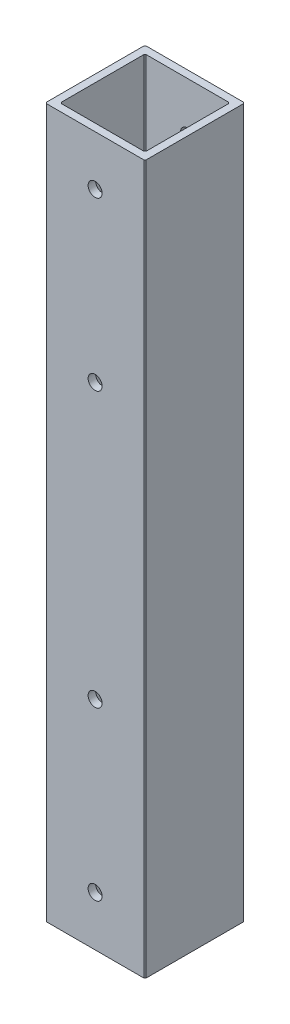
from build123d import *

# Parameters (mm, degrees)
SKETCH1_W                      = 40
SKETCH1_H                      = 284
BOSS_EXTRUDE1_DEPTH            = 40
SKETCH2_W                      = 34
SKETCH2_H                      = 34
CUT_EXTRUDE1_DEPTH             = 358.009803787
F_5_6_5_6_DIAMETER_HOLE1_D     = 5.6
F_5_6_5_6_DIAMETER_HOLE1_DEPTH = 3
F_5_6_5_6_DIAMETER_HOLE2_D     = 5.6
CHAMFER1_SIZE                  = 0.5


with BuildPart() as part:
    # Sketch1 → Boss-Extrude1 (new body)
    with BuildSketch(Plane.XY.offset(180)):
        with Locations((-100, 0)):
            Rectangle(SKETCH1_W, SKETCH1_H)
    extrude(amount=-BOSS_EXTRUDE1_DEPTH)

    # Sketch2 → Cut-Extrude1 (cut, through all)
    with BuildSketch(Plane.XZ.offset(142)):
        with Locations((-100, 160)):
            Rectangle(SKETCH2_W, SKETCH2_H)
    extrude(amount=-CUT_EXTRUDE1_DEPTH, mode=Mode.SUBTRACT)

    # Ø5.6 (5.6) Diameter Hole1
    with Locations(Plane(origin=(0, 0, 140), x_dir=(-1, 0, 0), z_dir=(0, 0, -1))):
        with Locations((100, 122), (100, 55), (100, -55), (100, -122)):
            Hole(F_5_6_5_6_DIAMETER_HOLE1_D / 2, depth=F_5_6_5_6_DIAMETER_HOLE1_DEPTH)

    # Ø5.6 (5.6) Diameter Hole2 (through all)
    with Locations(Plane(origin=(0, 0, 177), x_dir=(-1, 0, 0), z_dir=(0, 0, -1))):
        with Locations((100, 122), (100, 55), (100, -55), (100, -122)):
            Hole(F_5_6_5_6_DIAMETER_HOLE2_D / 2)

    # Chamfer1
    chamfer1_edges = [part.edges().sort_by_distance(p)[0] for p in [
        (-80, 0, 140),
        (-83, 0, 143),
        (-117, 0, 143),
        (-117, 0, 177),
        (-83, 0, 177),
        (-120, 0, 140),
        (-80, 0, 180),
        (-120, 0, 180),
    ]]
    chamfer(chamfer1_edges, length=CHAMFER1_SIZE)


solid = part.part
